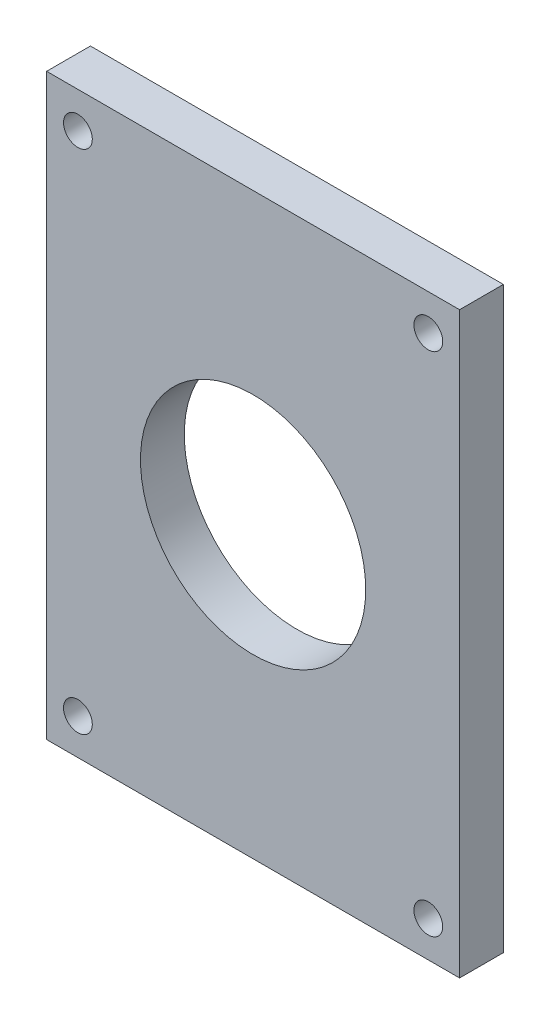
from build123d import *

# Parameters (mm, degrees)
UPPER_START               = 58
SKETCH1_W                 = 66
SKETCH1_H                 = 92.5
SKETCH1_R                 = 18
SKETCH1_R_2               = 2.3
UPPER_BEARING_PLATE_DEPTH = 7


with BuildPart() as part:
    # Sketch1 → Upper bearing plate (new body)
    with BuildSketch(Plane.XY.offset(UPPER_START)):
        Rectangle(SKETCH1_W, SKETCH1_H)
        Circle(SKETCH1_R, mode=Mode.SUBTRACT)
        with Locations((-28, -40.5)):
            Circle(SKETCH1_R_2, mode=Mode.SUBTRACT)
        with Locations((-28, 40.5)):
            Circle(SKETCH1_R_2, mode=Mode.SUBTRACT)
        with Locations((28, -40.5)):
            Circle(SKETCH1_R_2, mode=Mode.SUBTRACT)
        with Locations((28, 40.5)):
            Circle(SKETCH1_R_2, mode=Mode.SUBTRACT)
    extrude(amount=UPPER_BEARING_PLATE_DEPTH)


solid = part.part
